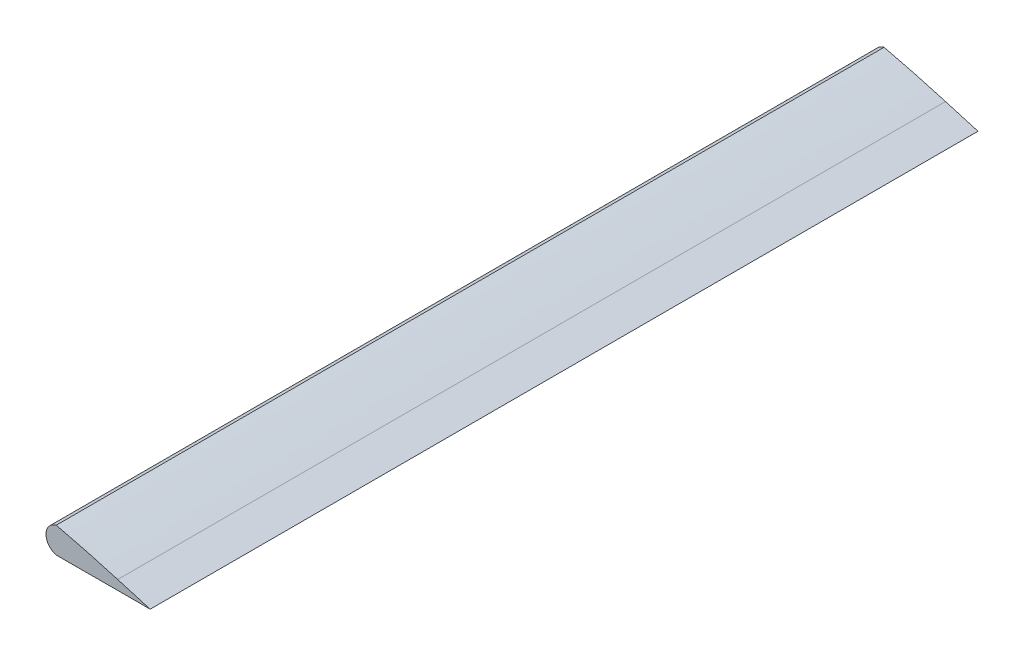
from build123d import *

# Parameters (mm, degrees)
BOSS_EXTRUDE1_DEPTH = 249


with BuildPart() as part:
    # Sketch1 → Boss-Extrude1 (new body)
    with BuildSketch(Plane.XY):
        with BuildLine():
            Line((189.698329187, 23.077647259), (207.849600842, 23.11245238))
            Line((207.849600842, 23.11245238), (217.965296171, 23.11245238))
            Line((217.965296171, 23.11245238), (208.199662873, 25.963149641))
            add(Edge.make_bspline(
                [(208.199662873, 25.963149641), (205.461210323, 26.762534479), (203.172469982, 27.404419223), (200.508776125, 28.151460912), (198.127071623, 28.777602141), (193.949594484, 29.875845298), (189.698329187, 30.854494337)],
                knots=[0, 0, 0, 0.25, 0.25, 0.5, 0.5, 0.915466563, 0.915466563, 0.915466563], degree=2))
            ThreePointArc((189.698329187, 30.854494337), (186.628644326, 26.966070798), (189.698329187, 23.077647259))
        make_face()
    extrude(amount=BOSS_EXTRUDE1_DEPTH)


solid = part.part
